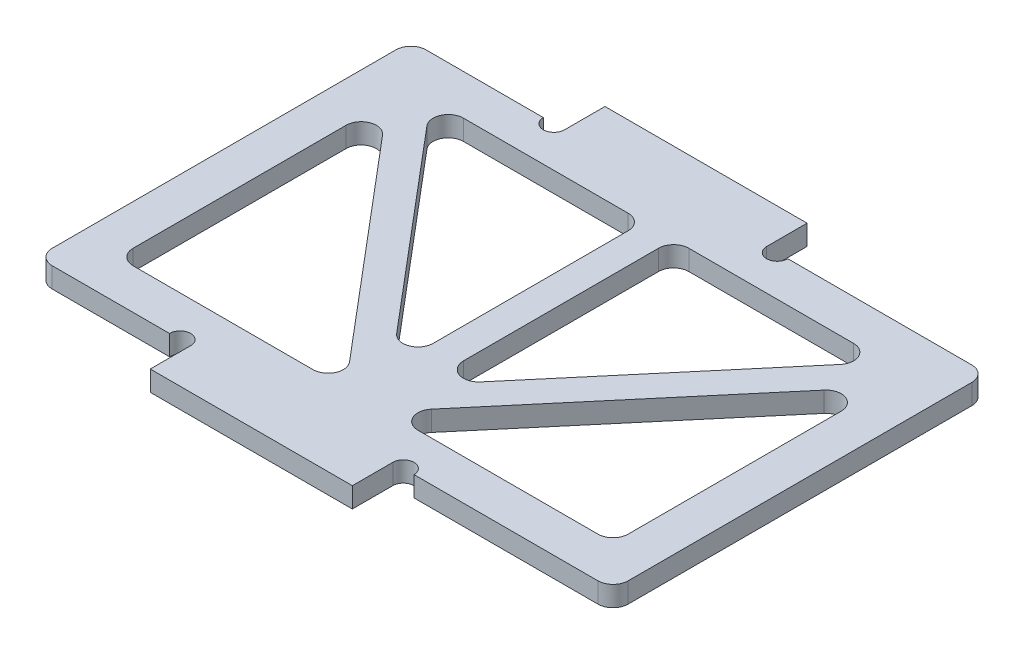
from build123d import *

# Parameters (mm, degrees)
SKETCH_1_W          = 57
SKETCH_1_H          = 37
EXTRUDE_1_DEPTH     = 2
SKETCH_2_W          = 20
SKETCH_2_H          = 2
EXTRUDE_2_DEPTH     = 4
SKETCH_3_R          = 1.05
CUT_EXTRUDE_1_DEPTH = 4
CUT_EXTRUDE_2_DEPTH = 10
FILLET_1_R          = 1.5


with BuildPart() as part:
    # 草图1 → 凸台-拉伸1 (new body)
    with BuildSketch(Plane(origin=(0, 0, 0), x_dir=(1, 0, 0), z_dir=(0, 1, 0))):
        Rectangle(SKETCH_1_W, SKETCH_1_H)
    extrude(amount=EXTRUDE_1_DEPTH)

    # 草图2 → 凸台-拉伸2 (add)
    with BuildSketch(Plane.XY.offset(18.5)):
        with Locations((-3.3, 1)):
            Rectangle(SKETCH_2_W, SKETCH_2_H)
    extrude_2 = extrude(amount=EXTRUDE_2_DEPTH)

    # 镜向1: 凸台-拉伸2 across plane
    add(extrude_2.mirror(Plane.XY))

    # 草图3 → 切除-拉伸1 (cut)
    with BuildSketch(Plane(origin=(0, 2, 0), x_dir=(1, 0, 0), z_dir=(0, 1, 0))):
        with Locations((7.75, 18.5)):
            Circle(SKETCH_3_R)
        with Locations((-14.35, 18.5)):
            Circle(SKETCH_3_R)
        with Locations((-14.35, -18.5)):
            Circle(SKETCH_3_R)
        with Locations((7.75, -18.5)):
            Circle(SKETCH_3_R)
    extrude(amount=-CUT_EXTRUDE_1_DEPTH, mode=Mode.SUBTRACT)

    # 草图4 → 切除-拉伸2 (cut)
    with BuildSketch(Plane(origin=(0, 2, 0), x_dir=(1, 0, 0), z_dir=(0, 1, 0))):
        Polygon((-24.5, -14.5), (-1.963644752, -14.5), (-24.5, 12.175685803), align=None)
        Polygon((-22.536355248, 14.5), (-1.5, -10.400175599), (-1.5, 14.5), align=None)
        Polygon((1.5, 14.5), (1.5, -10.400175599), (22.536355248, 14.5), align=None)
        Polygon((24.5, 12.175685803), (1.963644752, -14.5), (24.5, -14.5), align=None)
    extrude(amount=-CUT_EXTRUDE_2_DEPTH, mode=Mode.SUBTRACT)

    # 圆角1
    fillet_1_edges = [part.edges().sort_by_distance(p)[0] for p in [
        (1.963644752, 1, 14.5),
        (24.5, 1, -12.175685803),
        (24.5, 1, 14.5),
        (-24.5, 1, -12.175685803),
        (-1.963644752, 1, 14.5),
        (-24.5, 1, 14.5),
        (28.5, 1, 18.5),
        (-28.5, 1, 18.5),
        (-28.5, 1, -18.5),
        (28.5, 1, -18.5),
        (-22.536355248, 1, -14.5),
        (-1.5, 1, -14.5),
        (-1.5, 1, 10.400175599),
        (1.5, 1, -14.5),
        (22.536355248, 1, -14.5),
        (1.5, 1, 10.400175599),
    ]]
    fillet(fillet_1_edges, radius=FILLET_1_R)


solid = part.part
